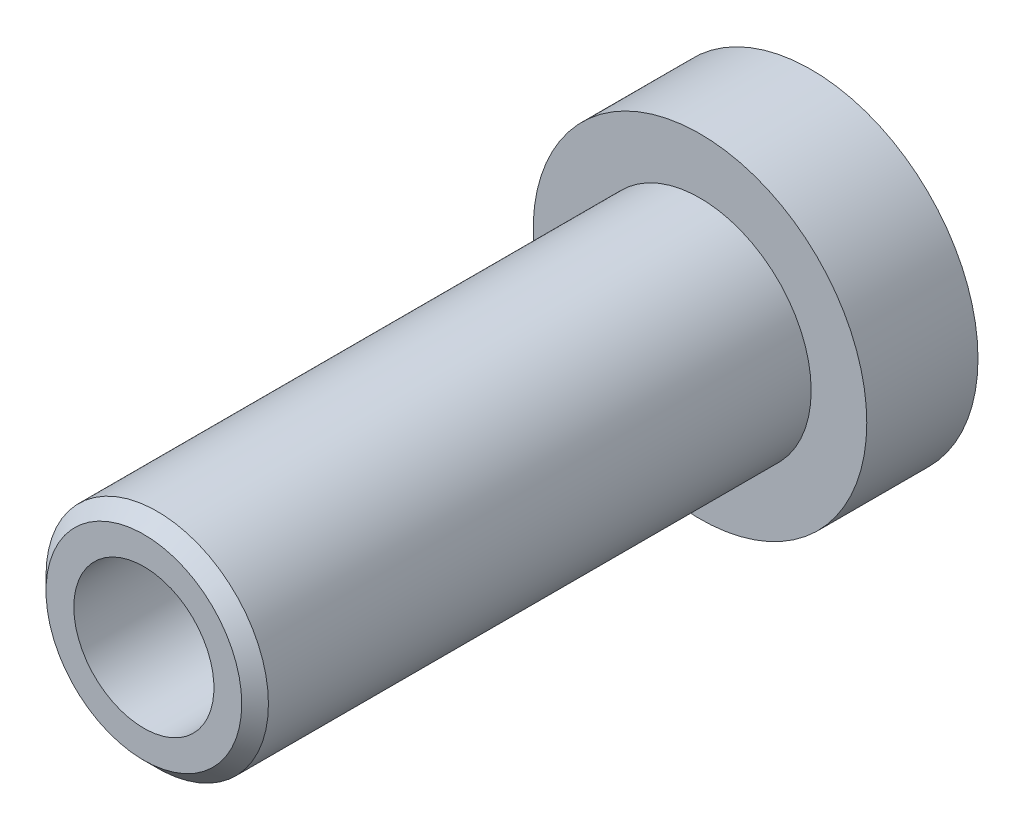
from build123d import *

# Parameters (mm, degrees)
SKETCH1_R           = 0.75
BOSS_EXTRUDE1_DEPTH = 0.5
SKETCH2_R           = 0.5
BOSS_EXTRUDE2_DEPTH = 2.5
SKETCH3_R           = 0.315
CUT_EXTRUDE1_DEPTH  = 3
CHAMFER1_SIZE       = 0.06


with BuildPart() as part:
    # Sketch1 → Boss-Extrude1 (new body)
    with BuildSketch(Plane.XY):
        Circle(SKETCH1_R)
    extrude(amount=BOSS_EXTRUDE1_DEPTH)

    # Sketch2 → Boss-Extrude2 (add)
    with BuildSketch(Plane.XY.offset(0.5)):
        Circle(SKETCH2_R)
    extrude(amount=BOSS_EXTRUDE2_DEPTH)

    # Sketch3 → Cut-Extrude1 (cut)
    with BuildSketch(Plane(origin=(0, 0, 0), x_dir=(-1, 0, 0), z_dir=(0, 0, -1))):
        Circle(SKETCH3_R)
    extrude(amount=-CUT_EXTRUDE1_DEPTH, mode=Mode.SUBTRACT)

    # Chamfer1
    chamfer1_edges = [part.edges().sort_by_distance(p)[0] for p in [
        (-0.5, 0, 3),
    ]]
    chamfer(chamfer1_edges, length=CHAMFER1_SIZE)


solid = part.part
